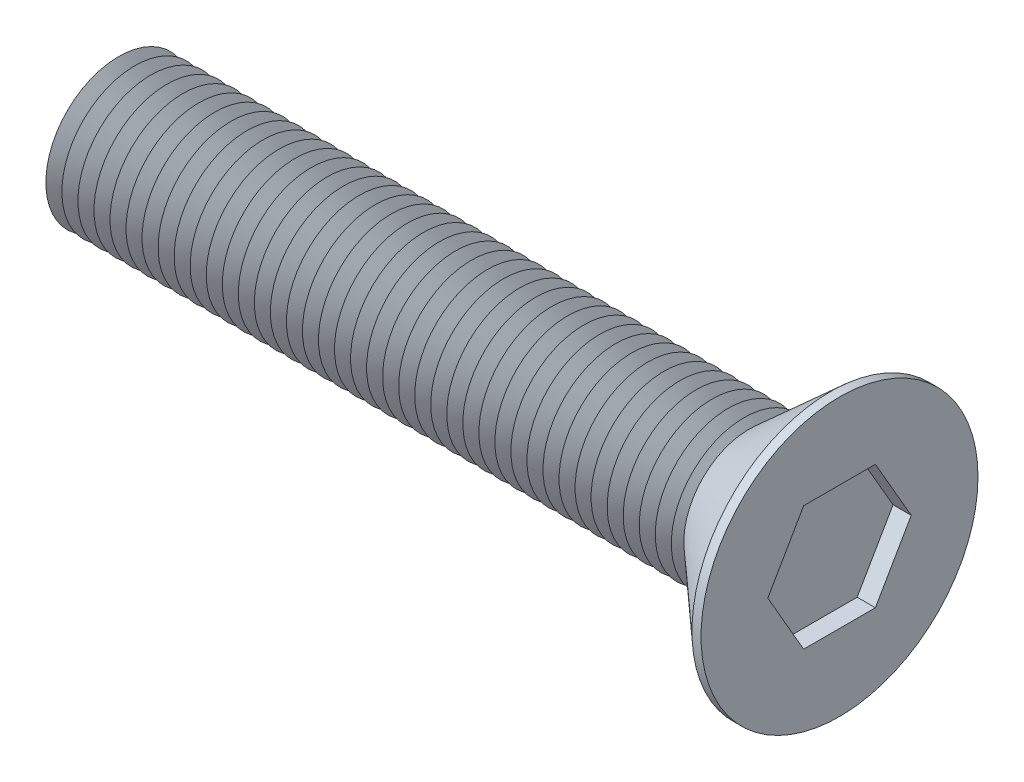
from build123d import *

# Parameters (mm, degrees)
CUT_EXTRUDE_1_DEPTH = 1


with BuildPart() as part:
    # 草图1 → 旋转1 (revolve)
    with BuildSketch(Plane.XY, mode=Mode.PRIVATE) as revolve_1_sk:
        Polygon((0, -3.3), (0, 0), (40, 0), (40, -7.6), (39.5, -7.6), (35.031347794, -3.578213015), (34.766177429, -4), (34.326099234, -3.3), (33.886021039, -4), (33.445942843, -3.3), (33.005864648, -4), (32.565786453, -3.3), (32.125708258, -4), (31.685630062, -3.3), (31.245551867, -4), (30.805473672, -3.3), (30.365395476, -4), (29.925317281, -3.3), (29.485239086, -4), (29.04516089, -3.3), (28.605082695, -4), (28.1650045, -3.3), (27.724926304, -4), (27.284848109, -3.3), (26.844769914, -4), (26.404691719, -3.3), (25.964613523, -4), (25.524535328, -3.3), (25.084457133, -4), (24.644378937, -3.3), (24.204300742, -4), (23.764222547, -3.3), (23.324144351, -4), (22.884066156, -3.3), (22.443987961, -4), (22.003909765, -3.3), (21.56383157, -4), (21.123753375, -3.3), (20.68367518, -4), (20.243596984, -3.3), (19.803518789, -4), (19.363440594, -3.3), (18.923362398, -4), (18.483284203, -3.3), (18.043206008, -4), (17.603127812, -3.3), (17.163049617, -4), (16.722971422, -3.3), (16.282893226, -4), (15.842815031, -3.3), (15.402736836, -4), (14.962658641, -3.3), (14.522580445, -4), (14.08250225, -3.3), (13.642424055, -4), (13.202345859, -3.3), (12.762267664, -4), (12.322189469, -3.3), (11.882111273, -4), (11.442033078, -3.3), (11.001954883, -4), (10.561876687, -3.3), (10.121798492, -4), (9.681720297, -3.3), (9.241642101, -4), (8.801563906, -3.3), (8.361485711, -4), (7.921407516, -3.3), (7.48132932, -4), (7.041251125, -3.3), (6.60117293, -4), (6.161094734, -3.3), (5.721016539, -4), (5.280938344, -3.3), (4.840860148, -4), (4.400781953, -3.3), (3.960703758, -4), (3.520625562, -3.3), (3.080547367, -4), (2.640469172, -3.3), (2.200390977, -4), (1.760312781, -3.3), (1.320234586, -4), (0.880156391, -3.3), (0.440078195, -4), align=None)
    revolve(revolve_1_sk.sketch.rotate(Axis((0.440078195, 0, 0), (1, 0, 0)), 90), axis=Axis((0.440078195, 0, 0), (1, 0, 0)))

    # 草图3 → 切除-拉伸1 (cut)
    with BuildSketch(Plane(origin=(40, 0, 0), x_dir=(0, 0, -1), z_dir=(1, 0, 0))):
        Polygon((3.936562889, 0), (1.968281444, 3.409163465), (-1.968281444, 3.409163465), (-3.936562889, 0), (-1.968281444, -3.409163465), (1.968281444, -3.409163465), align=None)
    extrude(amount=-CUT_EXTRUDE_1_DEPTH, mode=Mode.SUBTRACT)


solid = part.part
